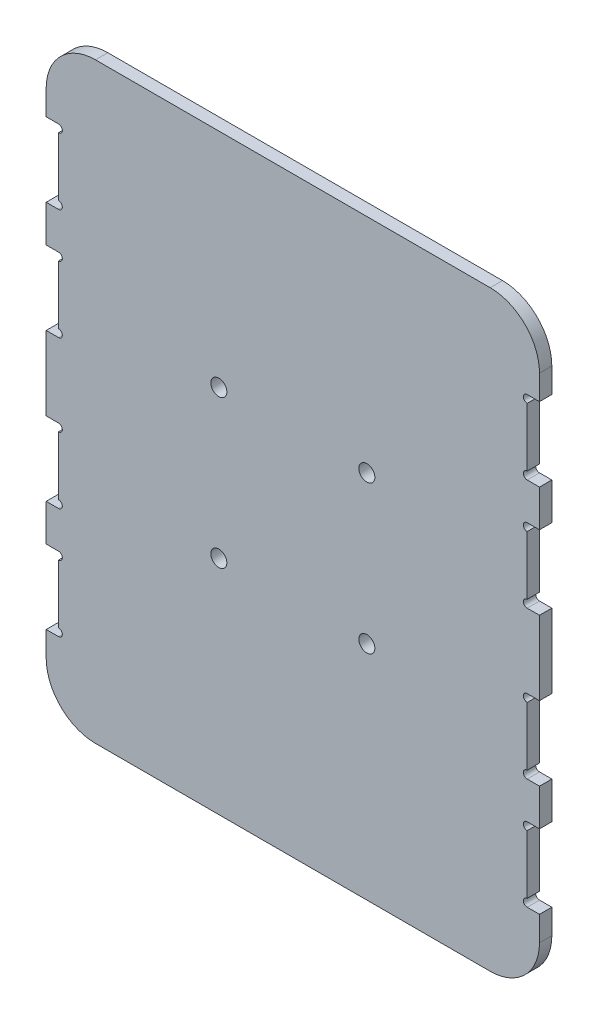
from build123d import *

# Parameters (mm, degrees)
SKETCH_1_W          = 200
SKETCH_1_H          = 240
SKETCH_1_R          = 3.25
EXTRUDE_1_DEPTH     = 5
FILLET_1_R          = 20
SKETCH_3_W          = 5
SKETCH_3_H          = 30
CUT_EXTRUDE_1_DEPTH = 39
SKETCH_4_R          = 1.55
CUT_EXTRUDE_2_DEPTH = 5


with BuildPart() as part:
    # 草图1 → 凸台-拉伸1 (new body)
    with BuildSketch(Plane.XY):
        Rectangle(SKETCH_1_W, SKETCH_1_H)
        with Locations((30, 30)):
            Circle(SKETCH_1_R, mode=Mode.SUBTRACT)
        with Locations(Location((30, -30, 0), (0, 0, 180))):
            Circle(SKETCH_1_R, mode=Mode.SUBTRACT)
        with Locations(Location((-30, 30, 0), (0, 0, 180))):
            Circle(SKETCH_1_R, mode=Mode.SUBTRACT)
        with Locations((-30, -30)):
            Circle(SKETCH_1_R, mode=Mode.SUBTRACT)
    extrude(amount=EXTRUDE_1_DEPTH)

    # 圆角1
    fillet_1_edges = [part.edges().sort_by_distance(p)[0] for p in [
        (-100, 120, 2.5),
        (-100, -120, 2.5),
        (100, -120, 2.5),
        (100, 120, 2.5),
    ]]
    fillet(fillet_1_edges, radius=FILLET_1_R)

    # 草图3 → 切除-拉伸1 (cut)
    with BuildSketch(Plane.XY.offset(5)):
        with Locations((97.5, 75)):
            Rectangle(SKETCH_3_W, SKETCH_3_H)
        with Locations((97.5, -30)):
            Rectangle(SKETCH_3_W, SKETCH_3_H)
        with Locations((97.5, 30)):
            Rectangle(SKETCH_3_W, SKETCH_3_H)
        with Locations((97.5, -75)):
            Rectangle(SKETCH_3_W, SKETCH_3_H)
        with Locations((-97.5, -75)):
            Rectangle(SKETCH_3_W, SKETCH_3_H)
        with Locations((-97.5, -30)):
            Rectangle(SKETCH_3_W, SKETCH_3_H)
        with Locations((-97.5, 30)):
            Rectangle(SKETCH_3_W, SKETCH_3_H)
        with Locations((-97.5, 75)):
            Rectangle(SKETCH_3_W, SKETCH_3_H)
    extrude(amount=-CUT_EXTRUDE_1_DEPTH, mode=Mode.SUBTRACT)

    # 草图4 → 切除-拉伸2 (cut)
    with BuildSketch(Plane.XY.offset(5)):
        with Locations((95, 88.45)):
            Circle(SKETCH_4_R)
        with Locations((95, 61.55)):
            Circle(SKETCH_4_R)
        with Locations((95, 43.45)):
            Circle(SKETCH_4_R)
        with Locations((95, 16.55)):
            Circle(SKETCH_4_R)
        with Locations((95, -16.55)):
            Circle(SKETCH_4_R)
        with Locations((95, -43.45)):
            Circle(SKETCH_4_R)
        with Locations((95, -61.55)):
            Circle(SKETCH_4_R)
        with Locations((95, -88.45)):
            Circle(SKETCH_4_R)
        with Locations((-95, -88.45)):
            Circle(SKETCH_4_R)
        with Locations((-95, -61.55)):
            Circle(SKETCH_4_R)
        with Locations((-95, -43.45)):
            Circle(SKETCH_4_R)
        with Locations((-95, -16.55)):
            Circle(SKETCH_4_R)
        with Locations((-95, 16.55)):
            Circle(SKETCH_4_R)
        with Locations((-95, 43.45)):
            Circle(SKETCH_4_R)
        with Locations((-95, 61.55)):
            Circle(SKETCH_4_R)
        with Locations((-95, 88.45)):
            Circle(SKETCH_4_R)
    extrude(amount=-CUT_EXTRUDE_2_DEPTH, mode=Mode.SUBTRACT)


solid = part.part
